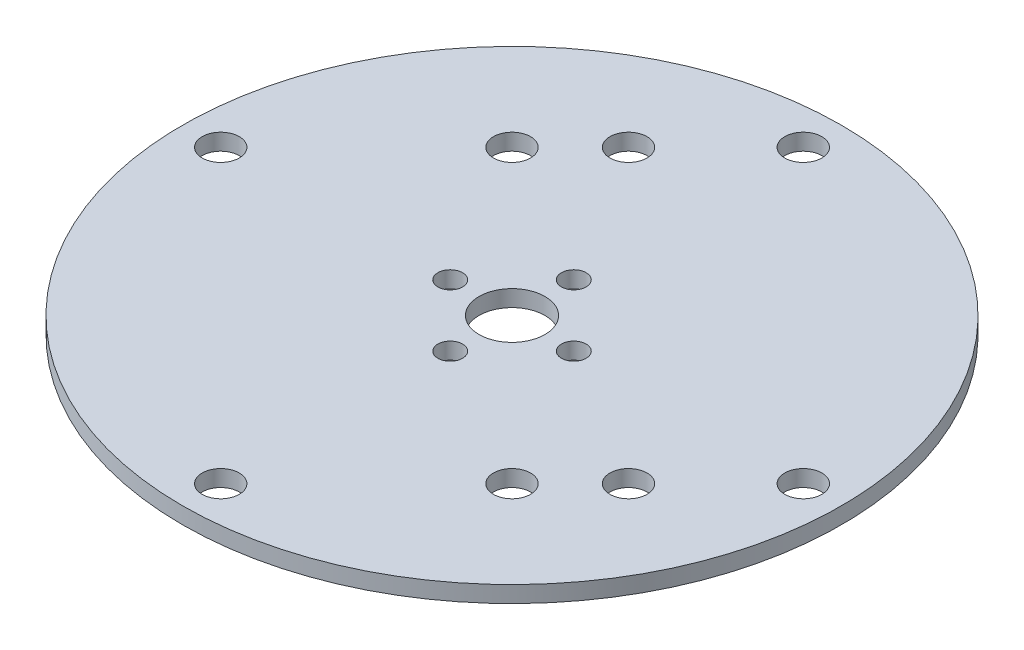
from build123d import *

# Parameters (mm, degrees)
SKETCH1_R           = 40
SKETCH1_R_2         = 2.25
SKETCH1_R_3         = 4
SKETCH1_R_4         = 1.5
BOSS_EXTRUDE2_DEPTH = 2


with BuildPart() as part:
    # Sketch1 → Boss-Extrude2 (new body)
    with BuildSketch(Plane(origin=(0, 0, 0), x_dir=(1, 0, 0), z_dir=(0, 1, 0))):
        with Locations(Location((0, 0, 0), (0, 0, 270))):
            Circle(SKETCH1_R)
        with Locations(Location((0, 35.355339059, 0), (0, 0, 270))):
            Circle(SKETCH1_R_2, mode=Mode.SUBTRACT)
        with Locations(Location((35.355339059, 0, 0), (0, 0, 270))):
            Circle(SKETCH1_R_2, mode=Mode.SUBTRACT)
        with Locations(Location((0, -35.355339059, 0), (0, 0, 270))):
            Circle(SKETCH1_R_2, mode=Mode.SUBTRACT)
        with Locations(Location((-35.355339059, 0, 0), (0, 0, 270))):
            Circle(SKETCH1_R_2, mode=Mode.SUBTRACT)
        with Locations(Location((-17.67766953, 17.67766953, 0), (0, 0, 270))):
            Circle(SKETCH1_R_2, mode=Mode.SUBTRACT)
        with Locations(Location((17.67766953, -17.67766953, 0), (0, 0, 270))):
            Circle(SKETCH1_R_2, mode=Mode.SUBTRACT)
        with Locations(Location((-10.606601718, 24.748737342, 0), (0, 0, 270))):
            Circle(SKETCH1_R_2, mode=Mode.SUBTRACT)
        with Locations(Location((24.748737342, -10.606601718, 0), (0, 0, 270))):
            Circle(SKETCH1_R_2, mode=Mode.SUBTRACT)
        with Locations(Location((0, 0, 0), (0, 0, 270))):
            Circle(SKETCH1_R_3, mode=Mode.SUBTRACT)
        with Locations(Location((0, 7.5, 0), (0, 0, 270))):
            Circle(SKETCH1_R_4, mode=Mode.SUBTRACT)
        with Locations(Location((7.5, 0, 0), (0, 0, 270))):
            Circle(SKETCH1_R_4, mode=Mode.SUBTRACT)
        with Locations(Location((0, -7.5, 0), (0, 0, 270))):
            Circle(SKETCH1_R_4, mode=Mode.SUBTRACT)
        with Locations(Location((-7.5, 0, 0), (0, 0, 270))):
            Circle(SKETCH1_R_4, mode=Mode.SUBTRACT)
    extrude(amount=BOSS_EXTRUDE2_DEPTH)


solid = part.part
